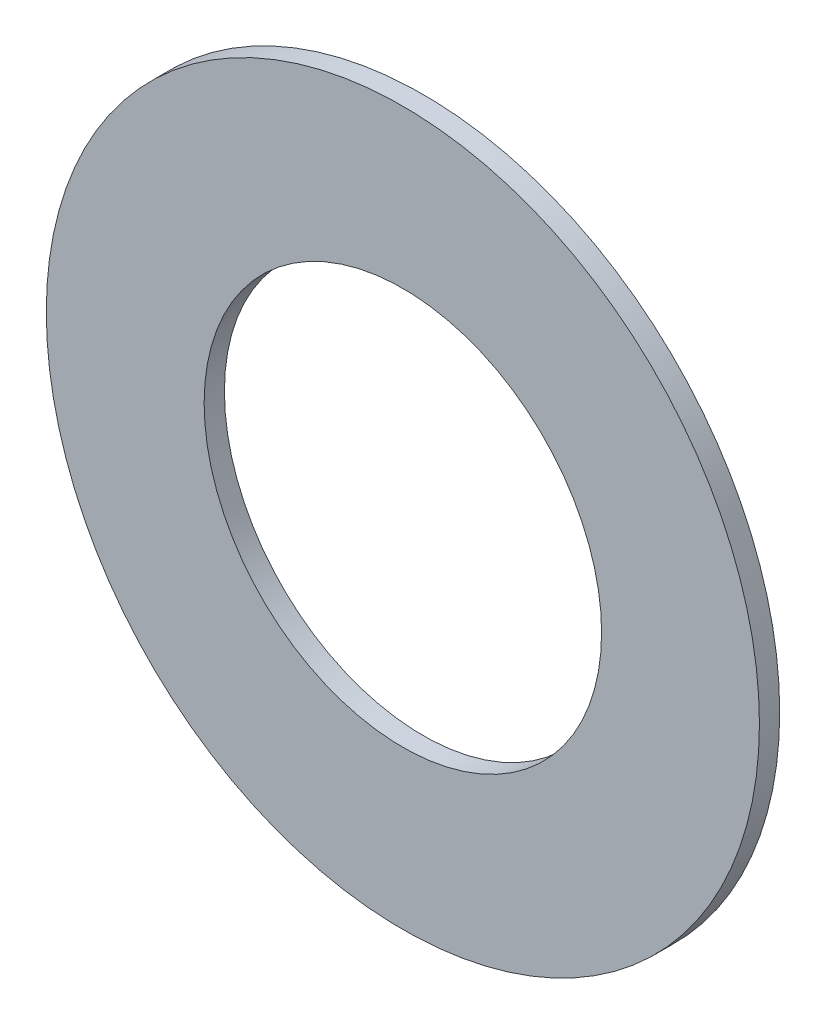
from build123d import *

# Parameters (mm, degrees)
BOSS_EXTRUDE1_DEPTH      = 0.4064
BOSS_EXTRUDE1_DEPTH_BACK = 0.4064
SKETCH3_R                = 14.2875
SKETCH3_R_2              = 7.9629


with BuildPart() as part:
    # Sketch3 → Boss-Extrude1 (new, two sides: drawn at the far end of the back side and taken through both)
    with BuildSketch(Plane.XY.offset(-BOSS_EXTRUDE1_DEPTH_BACK)):
        Circle(SKETCH3_R)
        Circle(SKETCH3_R_2, mode=Mode.SUBTRACT)
    extrude(amount=BOSS_EXTRUDE1_DEPTH + BOSS_EXTRUDE1_DEPTH_BACK)


solid = part.part
